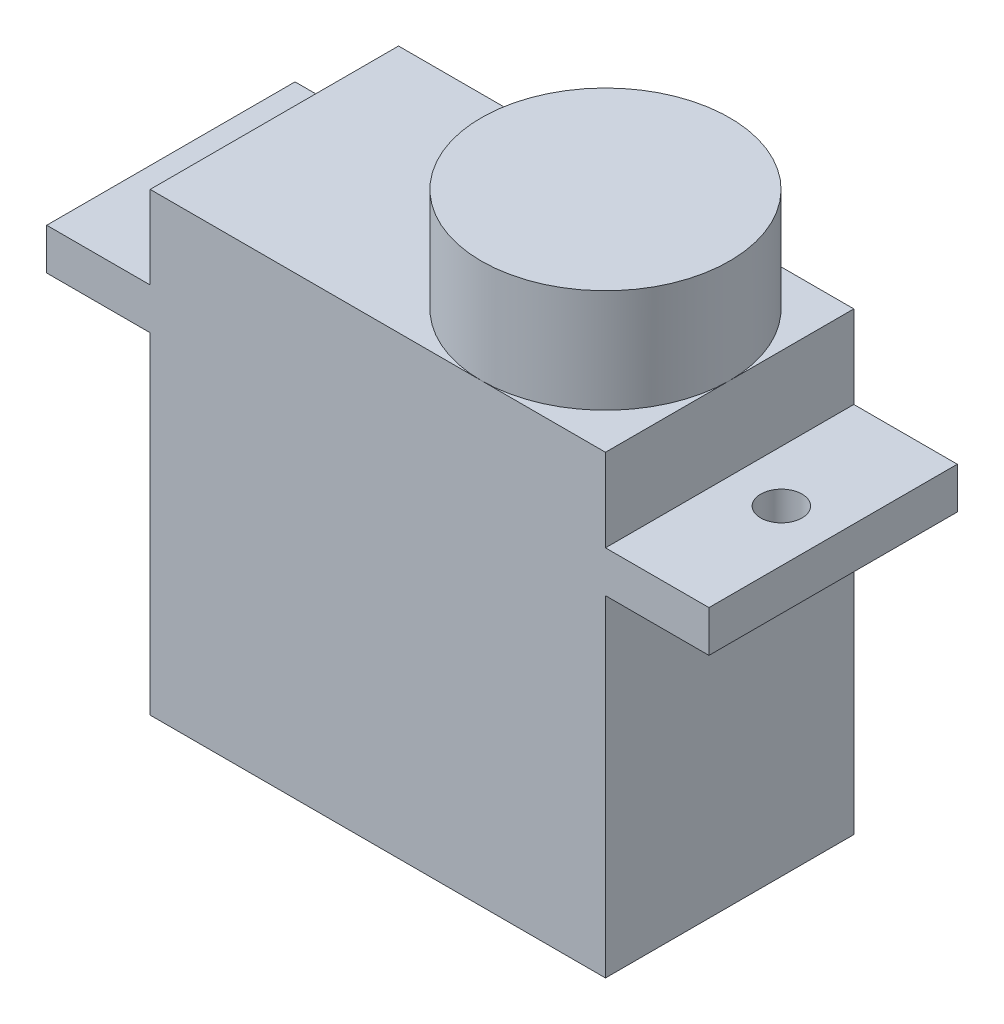
from build123d import *

# Parameters (mm, degrees)
SKETCH1_W           = 22
SKETCH1_H           = 12
BOSS_EXTRUDE1_DEPTH = 22
SKETCH2_W           = 32
SKETCH2_H           = 2
BOSS_EXTRUDE2_DEPTH = 12
SKETCH3_R           = 1
CUT_EXTRUDE1_DEPTH  = 22
SKETCH5_R           = 6
BOSS_EXTRUDE3_DEPTH = 5


with BuildPart() as part:
    # Sketch1 → Boss-Extrude1 (new body)
    with BuildSketch(Plane(origin=(0, 0, 0), x_dir=(1, 0, 0), z_dir=(0, 1, 0))):
        with Locations((11, 6)):
            Rectangle(SKETCH1_W, SKETCH1_H)
    extrude(amount=BOSS_EXTRUDE1_DEPTH)

    # Sketch2 → Boss-Extrude2 (add, through all)
    with BuildSketch(Plane.XY):
        with Locations((11, 17)):
            Rectangle(SKETCH2_W, SKETCH2_H)
    extrude(amount=-BOSS_EXTRUDE2_DEPTH)

    # Sketch3 → Cut-Extrude1 (cut)
    with BuildSketch(Plane(origin=(0, 18, 0), x_dir=(1, 0, 0), z_dir=(0, 1, 0))):
        with Locations(Location((-2.5, 6, 0), (0, 0, 270))):
            Circle(SKETCH3_R)
        with Locations(Location((24.5, 6, 0), (0, 0, 270))):
            Circle(SKETCH3_R)
    extrude(amount=-CUT_EXTRUDE1_DEPTH, mode=Mode.SUBTRACT)

    # Sketch5 → Boss-Extrude3 (add)
    with BuildSketch(Plane(origin=(0, 22, 0), x_dir=(1, 0, 0), z_dir=(0, 1, 0))):
        with Locations(Location((16, 6, 0), (0, 0, 270))):
            Circle(SKETCH5_R)
    extrude(amount=BOSS_EXTRUDE3_DEPTH)


solid = part.part
